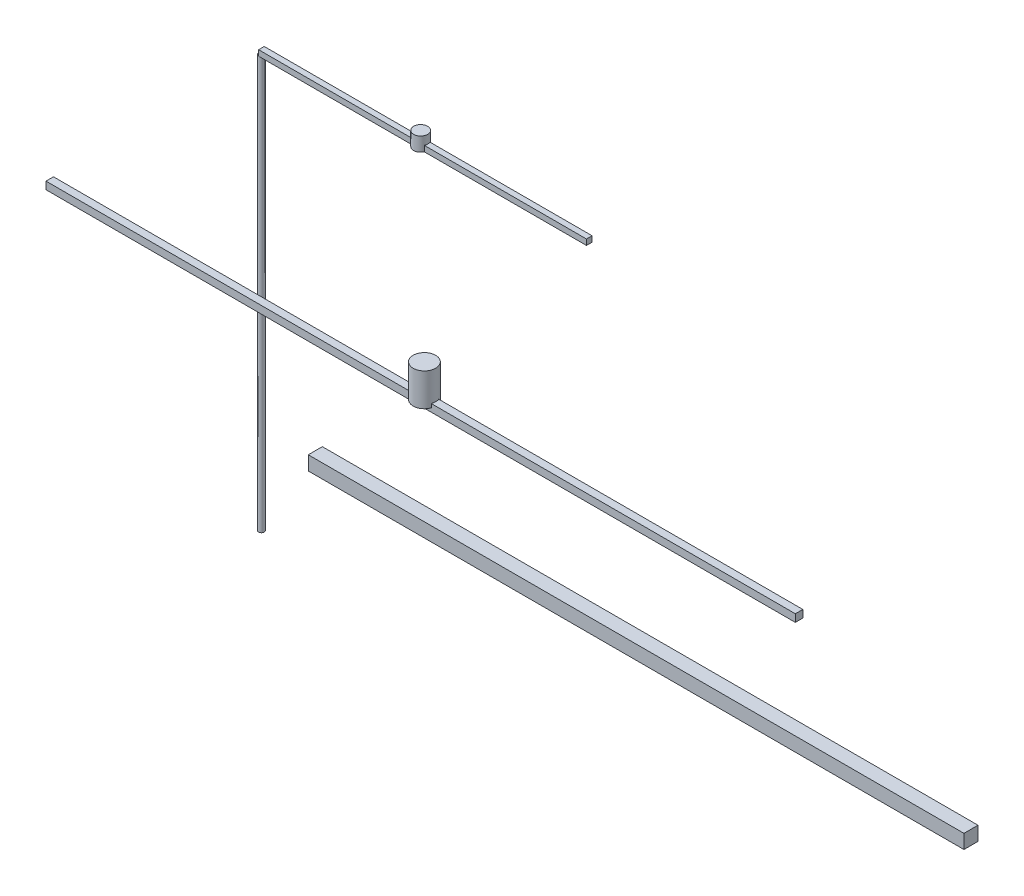
from build123d import *

# Parameters (mm, degrees)
SKETCH1_R           = 30
BOSS_EXTRUDE1_DEPTH = 4400
BOSS_EXTRUDE2_START = 4400
SKETCH2_W           = 3500
SKETCH2_H           = 60
BOSS_EXTRUDE2_DEPTH = 60
BOSS_EXTRUDE3_START = 4400
SKETCH3_R           = 75
BOSS_EXTRUDE3_DEPTH = 150
BOSS_EXTRUDE4_START = 3800
SKETCH4_W           = 8000
SKETCH4_H           = 80
BOSS_EXTRUDE4_DEPTH = 80
BOSS_EXTRUDE5_START = 3840
SKETCH5_R           = 120
BOSS_EXTRUDE5_DEPTH = 350
BOSS_EXTRUDE6_START = 300
SKETCH6_W           = 7000
SKETCH6_H           = 150
BOSS_EXTRUDE6_DEPTH = 150


with BuildPart() as part:
    # Sketch1 → Boss-Extrude1 (new body)
    with BuildSketch(Plane(origin=(0, 0, 0), x_dir=(1, 0, 0), z_dir=(0, 1, 0))):
        with Locations(Location((-3500, 0, 0), (0, 0, 270))):
            Circle(SKETCH1_R)
    extrude(amount=BOSS_EXTRUDE1_DEPTH)

    # Sketch2 → Boss-Extrude2 (add)
    with BuildSketch(Plane(origin=(0, 0, 0), x_dir=(1, 0, 0), z_dir=(0, 1, 0)).offset(BOSS_EXTRUDE2_START)):
        with Locations((-1750, 0)):
            Rectangle(SKETCH2_W, SKETCH2_H)
    extrude(amount=BOSS_EXTRUDE2_DEPTH)

    # Sketch3 → Boss-Extrude3 (add)
    with BuildSketch(Plane(origin=(0, 0, 0), x_dir=(1, 0, 0), z_dir=(0, 1, 0)).offset(BOSS_EXTRUDE3_START)):
        with Locations(Location((-1800, 0, 0), (0, 0, 23.578178478))):
            Circle(SKETCH3_R)
    extrude(amount=BOSS_EXTRUDE3_DEPTH)


with BuildPart() as body_2:
    # Sketch4 → Boss-Extrude4 (new body)
    with BuildSketch(Plane(origin=(0, 0, 0), x_dir=(1, 0, 0), z_dir=(0, 1, 0)).offset(BOSS_EXTRUDE4_START)):
        with Locations((0, -1760)):
            Rectangle(SKETCH4_W, SKETCH4_H)
    extrude(amount=BOSS_EXTRUDE4_DEPTH)

    # Sketch5 → Boss-Extrude5 (add)
    with BuildSketch(Plane(origin=(0, 0, 0), x_dir=(1, 0, 0), z_dir=(0, 1, 0)).offset(BOSS_EXTRUDE5_START)):
        with Locations(Location((0, -1760, 0), (0, 0, 160.528779366))):
            Circle(SKETCH5_R)
    extrude(amount=BOSS_EXTRUDE5_DEPTH)


with BuildPart() as body_3:
    # Sketch6 → Boss-Extrude6 (new body)
    with BuildSketch(Plane(origin=(0, 0, 0), x_dir=(1, 0, 0), z_dir=(0, 1, 0)).offset(BOSS_EXTRUDE6_START)):
        with Locations((0, 575)):
            Rectangle(SKETCH6_W, SKETCH6_H)
    extrude(amount=BOSS_EXTRUDE6_DEPTH)


solid = Compound([part.part, body_2.part, body_3.part])
